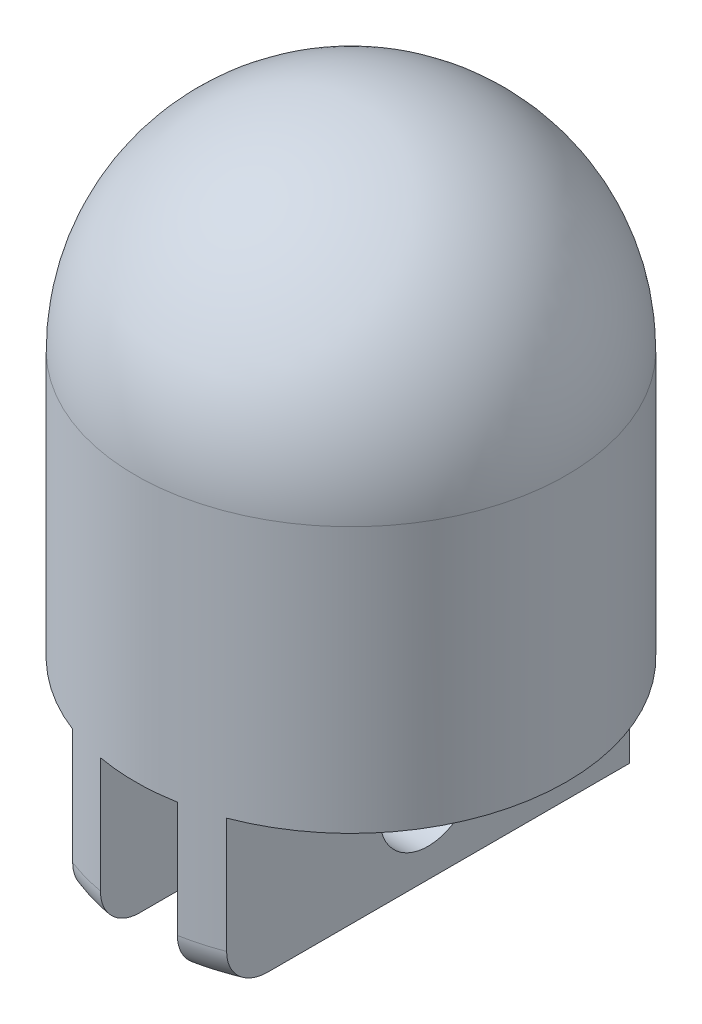
from build123d import *

# Parameters (mm, degrees)
CUT_EXTRUDE1_DEPTH = 10.16
SKETCH3_R          = 3.175
CUT_EXTRUDE2_DEPTH = 49.284725245
FILLET1_R          = 2.54


with BuildPart() as part:
    # Sketch1 → Revolve1 (revolve)
    with BuildSketch(Plane.XY):
        with BuildLine():
            Line((0, 0), (0, 5.602635041))
            Line((0, 5.602635041), (-2.54, 5.602635041))
            Line((-2.54, 5.602635041), (-2.54, 22.86))
            ThreePointArc((-2.54, 22.86), (-5.294384008, 28.994194932), (0, 33.139611281))
            Line((0, 33.139611281), (0, 41.91))
            ThreePointArc((0, 41.91), (-10.057886856, 37.743886856), (-14.224, 27.686))
            Line((-14.224, 27.686), (-14.224, 0))
            Line((-14.224, 0), (0, 0))
        make_face()
    revolve(axis=Axis((0, 0, 0), (0, 1, 0)))

    # Sketch2 → Cut-Extrude1 (cut)
    with BuildSketch(Plane.XZ):
        with BuildLine():
            Line((-2.54, 13.995376951), (-2.54, -13.995376951))
            ThreePointArc((-2.54, -13.995376951), (0, -14.224), (2.54, -13.995376951))
            Line((2.54, -13.995376951), (2.54, 13.995376951))
            ThreePointArc((2.54, 13.995376951), (0, 14.224), (-2.54, 13.995376951))
        make_face()
        with BuildLine():
            Line((-5.08, 13.28592398), (-5.08, -13.28592398))
            ThreePointArc((-5.08, -13.28592398), (-14.224, 0), (-5.08, 13.28592398))
        make_face()
        with BuildLine():
            Line((5.08, 13.28592398), (5.08, -13.28592398))
            ThreePointArc((5.08, -13.28592398), (14.224, 0), (5.08, 13.28592398))
        make_face()
    extrude(amount=-CUT_EXTRUDE1_DEPTH, mode=Mode.SUBTRACT)

    # Sketch3 → Cut-Extrude2 (cut, through all)
    with BuildSketch(Plane.ZY.offset(5.08)):
        with Locations((0, 5.08)):
            Circle(SKETCH3_R)
    extrude(amount=-CUT_EXTRUDE2_DEPTH, mode=Mode.SUBTRACT)

    # Fillet1
    fillet1_edges = [part.edges().sort_by_distance(p)[0] for p in [
        (3.826477607, 0, 13.699643978),
        (-3.826477607, 0, 13.699643978),
    ]]
    fillet(fillet1_edges, radius=FILLET1_R)


solid = part.part
